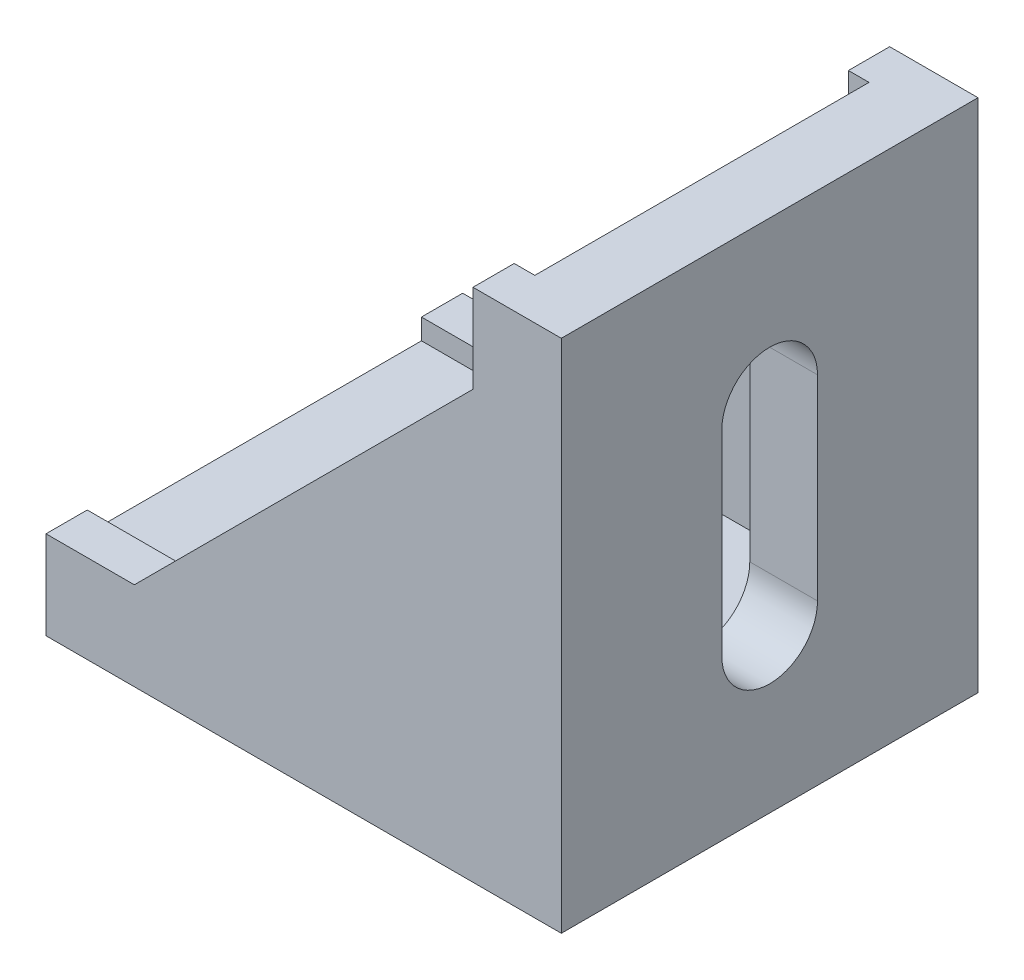
from build123d import *

# Parameters (mm, degrees)
EXTRUDE_1_DEPTH     = 14.15
SKETCH_2_W          = 30.4
SKETCH_2_H          = 30.4
CUT_EXTRUDE_1_DEPTH = 11.35
CUT_EXTRUDE_2_REACH = 53.48
CUT_EXTRUDE_3_REACH = 53.48


with BuildPart() as part:
    # 草图1 → 凸台-拉伸1 (new, symmetric)
    with BuildSketch(Plane.XY):
        Polygon((0, 0), (35, 0), (35, 35), (29, 35), (29, 29), (6, 6), (0, 6), align=None)
    extrude(amount=EXTRUDE_1_DEPTH, both=True)

    # 草图2 → 切除-拉伸1 (cut, symmetric)
    with BuildSketch(Plane.XY):
        with Locations((15.2, 19.8)):
            Rectangle(SKETCH_2_W, SKETCH_2_H)
    extrude(amount=CUT_EXTRUDE_1_DEPTH, both=True, mode=Mode.SUBTRACT)

    # 草图4 → 切除-拉伸2 (cut, up to next)
    with BuildSketch(Plane(origin=(0, 0, 0), x_dir=(1, 0, 0), z_dir=(0, 1, 0)), mode=Mode.PRIVATE) as cut_extrude_2_sk1:
        with BuildLine():
            Line((10.85, 3.25), (24.15, 3.25))
            ThreePointArc((24.15, 3.25), (27.4, 0), (24.15, -3.25))
            Line((24.15, -3.25), (10.85, -3.25))
            ThreePointArc((10.85, -3.25), (7.6, 0), (10.85, 3.25))
        make_face()
    cut_extrude_2_tool1 = extrude(cut_extrude_2_sk1.sketch, amount=CUT_EXTRUDE_2_REACH, mode=Mode.PRIVATE) & part.part
    add(cut_extrude_2_tool1.solids().sort_by_distance((17.5, 0, 0))[0], mode=Mode.SUBTRACT)

    # 草图5 → 切除-拉伸3 (cut, up to next)
    with BuildSketch(Plane(origin=(0, 0, 0), x_dir=(0, 0, -1), z_dir=(1, 0, 0)), mode=Mode.PRIVATE) as cut_extrude_3_sk1:
        with BuildLine():
            Line((-3.25, 10.85), (-3.25, 24.15))
            ThreePointArc((-3.25, 24.15), (0, 27.4), (3.25, 24.15))
            Line((3.25, 24.15), (3.25, 10.85))
            ThreePointArc((3.25, 10.85), (0, 7.6), (-3.25, 10.85))
        make_face()
    cut_extrude_3_tool1 = extrude(cut_extrude_3_sk1.sketch, amount=CUT_EXTRUDE_3_REACH, mode=Mode.PRIVATE) & part.part
    add(cut_extrude_3_tool1.solids().sort_by_distance((0, 17.5, 0))[0], mode=Mode.SUBTRACT)


solid = part.part
